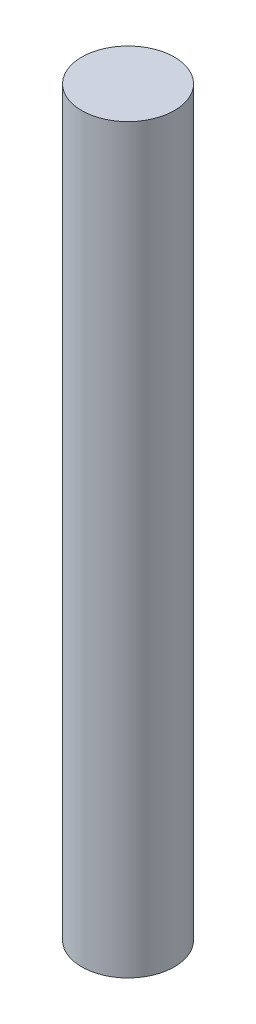
from build123d import *

# Parameters (mm, degrees)
SKETCH1_R           = 9.525
BOSS_EXTRUDE1_DEPTH = 152.4


with BuildPart() as part:
    # Sketch1 → Boss-Extrude1 (new body)
    with BuildSketch(Plane(origin=(0, 0, 0), x_dir=(1, 0, 0), z_dir=(0, 1, 0))):
        with Locations(Location((0, 0, 0), (0, 0, 90))):
            Circle(SKETCH1_R)
    extrude(amount=BOSS_EXTRUDE1_DEPTH)


solid = part.part
